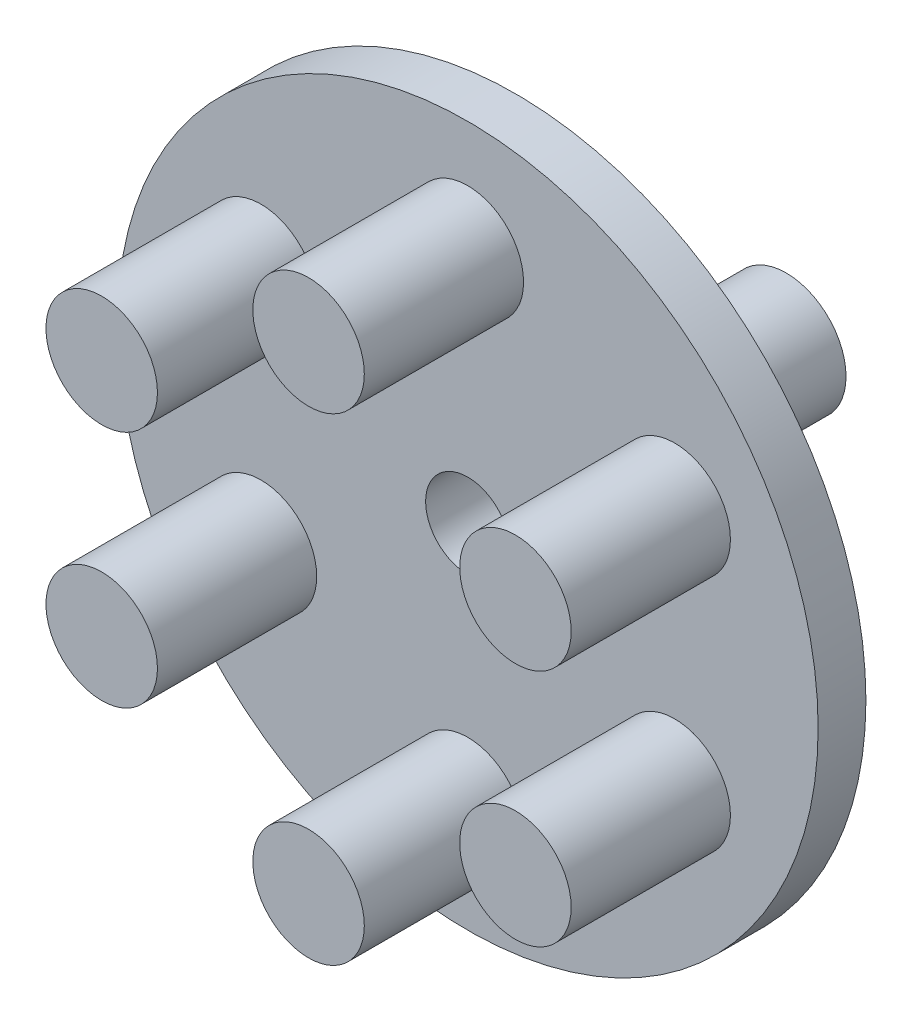
from build123d import *
from build123d.topology import SkipClean

# Parameters (mm, degrees)
SKETCH1_R           = 22
SKETCH1_R_2         = 2.65
BOSS_EXTRUDE1_DEPTH = 3
SKETCH2_R           = 3.5
BOSS_EXTRUDE2_DEPTH = 10
BOSS_EXTRUDE3_START = 17
SKETCH3_R           = 3.75
SKETCH3_R_2         = 2.65
BOSS_EXTRUDE3_DEPTH = 17


with BuildPart() as part:
    # Sketch1 → Boss-Extrude1 (new body)
    with BuildSketch(Plane.XY):
        Circle(SKETCH1_R)
        Circle(SKETCH1_R_2, mode=Mode.SUBTRACT)
    extrude(amount=BOSS_EXTRUDE1_DEPTH)

    # Sketch2 → Boss-Extrude2 (add)
    with BuildSketch(Plane.XY.offset(3)):
        with Locations((0, 15)):
            Circle(SKETCH2_R)
        with Locations((12.990381057, 7.5)):
            Circle(SKETCH2_R)
        with Locations((12.990381057, -7.5)):
            Circle(SKETCH2_R)
        with Locations((0, -15)):
            Circle(SKETCH2_R)
        with Locations((-12.990381057, -7.5)):
            Circle(SKETCH2_R)
        with Locations((-12.990381057, 7.5)):
            Circle(SKETCH2_R)
    extrude(amount=BOSS_EXTRUDE2_DEPTH)

    # Sketch3 → Boss-Extrude3 (add)
    with SkipClean():  # the faces are left unmerged after this step: merging them gives an invalid solid
        with BuildSketch(Plane(origin=(0, 0, 0), x_dir=(-1, 0, 0), z_dir=(0, 0, -1)).offset(BOSS_EXTRUDE3_START)):
            with Locations(Location((0, 0, 0), (0, 0, 180))):
                Circle(SKETCH3_R)
            Circle(SKETCH3_R_2, mode=Mode.SUBTRACT)
        extrude(amount=-BOSS_EXTRUDE3_DEPTH)


solid = part.part
